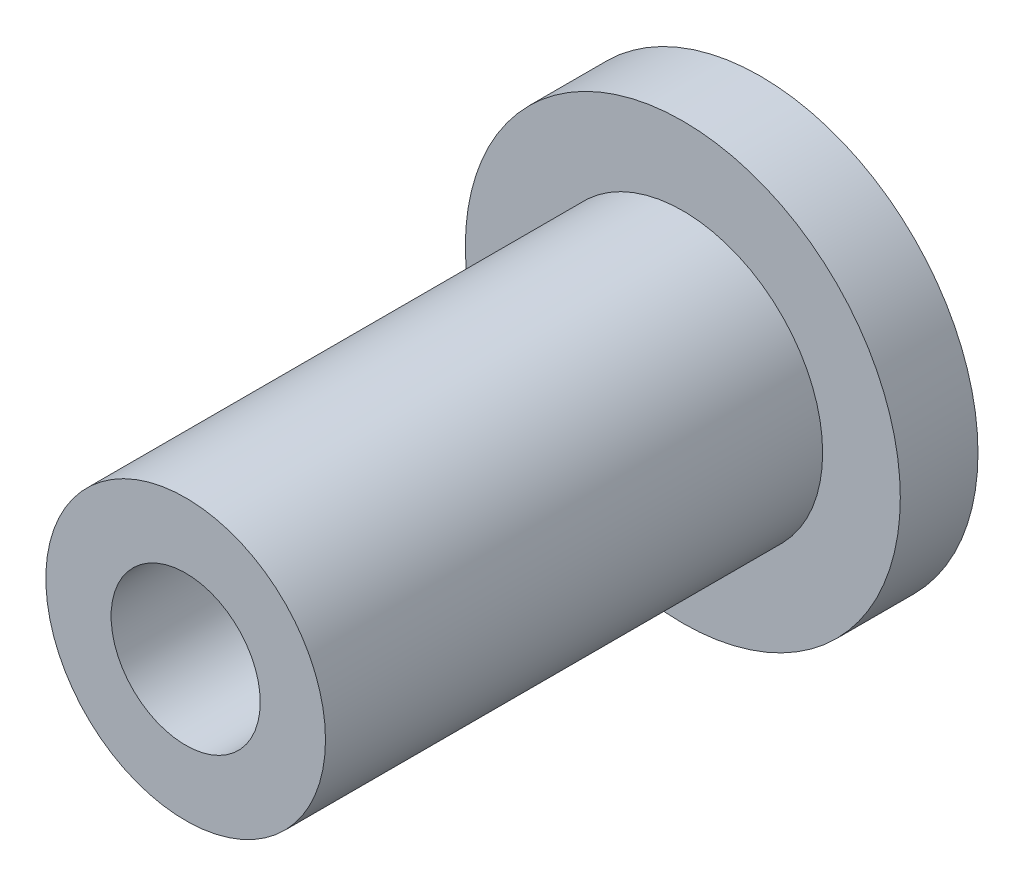
from build123d import *

# Parameters (mm, degrees)
SKETCH1_R           = 7
BOSS_EXTRUDE1_DEPTH = 2.5
SKETCH2_R           = 4.5
BOSS_EXTRUDE2_DEPTH = 16
SKETCH3_R           = 2.4
CUT_EXTRUDE1_DEPTH  = 5


with BuildPart() as part:
    # Sketch1 → Boss-Extrude1 (new body)
    with BuildSketch(Plane.XY):
        Circle(SKETCH1_R)
    extrude(amount=BOSS_EXTRUDE1_DEPTH)

    # Sketch2 → Boss-Extrude2 (add)
    with BuildSketch(Plane.XY.offset(2.5)):
        Circle(SKETCH2_R)
    extrude(amount=BOSS_EXTRUDE2_DEPTH)

    # Sketch3 → Cut-Extrude1 (cut)
    with BuildSketch(Plane.XY.offset(18.5)):
        Circle(SKETCH3_R)
    extrude(amount=-CUT_EXTRUDE1_DEPTH, mode=Mode.SUBTRACT)


solid = part.part
